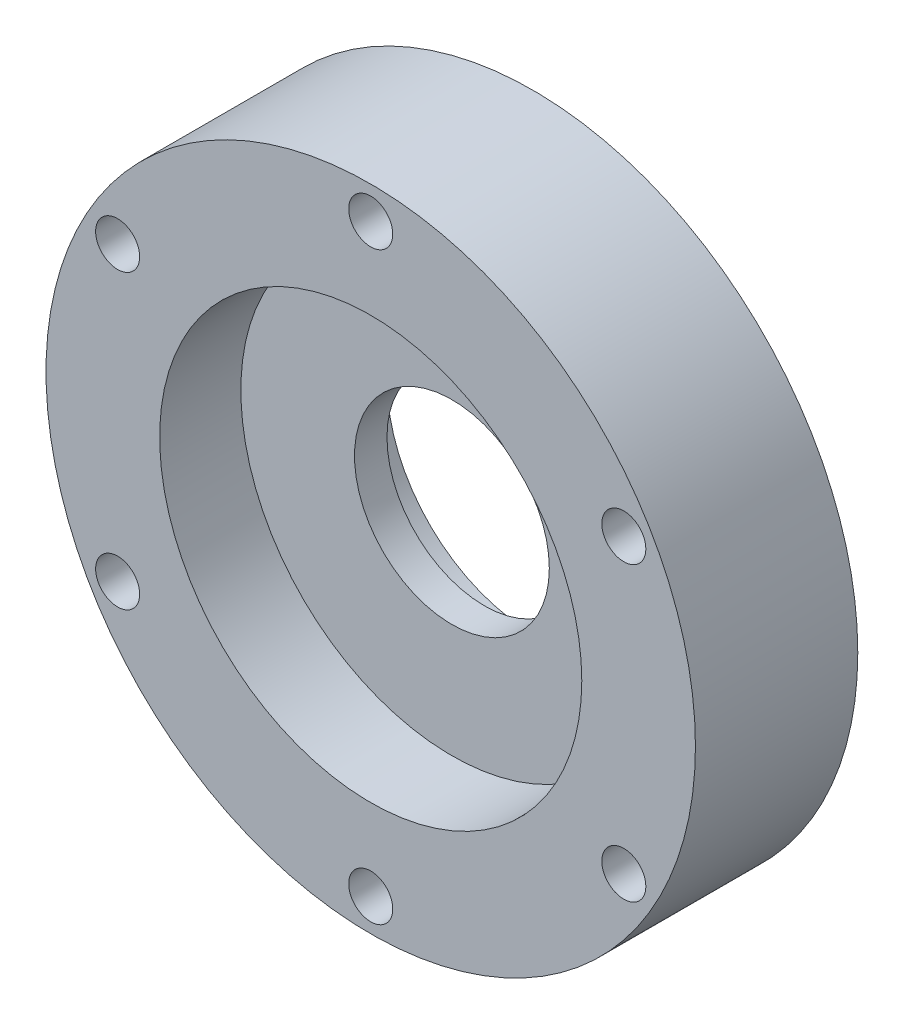
from build123d import *

# Parameters (mm, degrees)
SKETCH1_R             = 31.75
BOSS_EXTRUDE1_DEPTH   = 15.875
SKETCH2_R             = 20.6375
CUT_EXTRUDE1_DEPTH    = 7.9375
SKETCH3_R             = 14.2875
CUT_EXTRUDE2_DEPTH    = 4.7625
SKETCH4_R             = 9.525
CUT_EXTRUDE3_DEPTH    = 46.597466007
F_8_CLEARANCE_HOLE1_D = 4.3053
CUT_EXTRUDE4_DEPTH    = 12.7
CIRPATTERN1_COUNT     = 6
CUT_EXTRUDE5_DEPTH    = 4.7625
CIRPATTERN2_COUNT     = 6


with BuildPart() as part:
    # Sketch1 → Boss-Extrude1 (new body)
    with BuildSketch(Plane.XY):
        Circle(SKETCH1_R)
    extrude(amount=BOSS_EXTRUDE1_DEPTH)

    # Sketch2 → Cut-Extrude1 (cut)
    with BuildSketch(Plane.XY.offset(15.875)):
        Circle(SKETCH2_R)
    extrude(amount=-CUT_EXTRUDE1_DEPTH, mode=Mode.SUBTRACT)

    # Sketch3 → Cut-Extrude2 (cut)
    with BuildSketch(Plane(origin=(0, 0, 0), x_dir=(-1, 0, 0), z_dir=(0, 0, -1))):
        Circle(SKETCH3_R)
    extrude(amount=-CUT_EXTRUDE2_DEPTH, mode=Mode.SUBTRACT)

    # Sketch4 → Cut-Extrude3 (cut, through all)
    with BuildSketch(Plane.XY.offset(7.9375)):
        Circle(SKETCH4_R)
    extrude(amount=-CUT_EXTRUDE3_DEPTH, mode=Mode.SUBTRACT)

    # #8 Clearance Hole1 (through all)
    with Locations(Plane.XY.offset(15.875)):
        with Locations((0, 28.575), (24.746675913, 14.2875), (24.746675913, -14.2875), (0, -28.575), (-24.746675913, -14.2875), (-24.746675913, 14.2875)):
            Hole(F_8_CLEARANCE_HOLE1_D / 2)

    # Sketch8 → Cut-Extrude4 (cut)
    with BuildSketch(Plane(origin=(0, 0, 0), x_dir=(-1, 0, 0), z_dir=(0, 0, -1))):
        with BuildLine():
            ThreePointArc((3.163956488, 28.310416667), (3.772294429, 29.431991344), (5.009597773, 29.743576389))
            ThreePointArc((5.009597773, 29.743576389), (15.08125, 26.121491242), (23.253893866, 19.210227129))
            ThreePointArc((23.253893866, 19.210227129), (23.602704974, 17.982898478), (22.935561781, 16.895275029))
            ThreePointArc((22.935561781, 16.895275029), (21.932102472, 15.756785998), (21.571679673, 14.282613938))
            ThreePointArc((21.571679673, 14.282613938), (21.359607232, 13.487479006), (20.777931553, 12.905355579))
            Line((20.777931553, 12.905355579), (20.125711655, 12.528796246))
            ThreePointArc((20.125711655, 12.528796246), (18.998160274, 12.351602268), (18.043164212, 12.976704136))
            ThreePointArc((18.043164212, 12.976704136), (11.1125, 19.247414599), (2.216573333, 22.11419064))
            ThreePointArc((2.216573333, 22.11419064), (1.197721204, 22.628690556), (0.7874, 23.693775686))
            Line((0.7874, 23.693775686), (0.7874, 24.446894352))
            ThreePointArc((0.7874, 24.446894352), (1.000695836, 25.241701981), (1.583266667, 25.822929568))
            ThreePointArc((1.583266667, 25.822929568), (2.679725721, 26.872150898), (3.163956488, 28.310416667))
        make_face()
    cut_extrude4 = extrude(amount=-CUT_EXTRUDE4_DEPTH, mode=Mode.SUBTRACT)

    # CirPattern1: Cut-Extrude4 ×6 about axis
    cirpattern1_axis = Axis((0, 0, 0), (0, 0, 1))
    for i in range(1, CIRPATTERN1_COUNT):
        add(cut_extrude4.rotate(cirpattern1_axis, i * 360 / CIRPATTERN1_COUNT), mode=Mode.SUBTRACT)

    # Sketch9 → Cut-Extrude5 (cut)
    with BuildSketch(Plane(origin=(0, 0, 0), x_dir=(-1, 0, 0), z_dir=(0, 0, -1))):
        with BuildLine():
            ThreePointArc((3.163956488, 28.310416667), (3.772294429, 29.431991344), (5.009597773, 29.743576389))
            ThreePointArc((5.009597773, 29.743576389), (15.08125, 26.121491242), (23.253893866, 19.210227129))
            ThreePointArc((23.253893866, 19.210227129), (23.602704974, 17.982898478), (22.935561781, 16.895275029))
            ThreePointArc((22.935561781, 16.895275029), (21.932102472, 15.756785998), (21.571679673, 14.282613938))
            ThreePointArc((21.571679673, 14.282613938), (21.359607232, 13.487479006), (20.777931553, 12.905355579))
            Line((20.777931553, 12.905355579), (14.588758649, 9.332034937))
            ThreePointArc((14.588758649, 9.332034937), (13.489603645, 9.149004306), (12.540916954, 9.733500242))
            ThreePointArc((12.540916954, 9.733500242), (7.9375, 13.748153285), (2.159, 15.72750279))
            ThreePointArc((2.159, 15.72750279), (1.178468326, 16.256841597), (0.7874, 17.300253069))
            Line((0.7874, 17.300253069), (0.7874, 24.446894352))
            ThreePointArc((0.7874, 24.446894352), (1.000695836, 25.241701981), (1.583266667, 25.822929568))
            ThreePointArc((1.583266667, 25.822929568), (2.679725721, 26.872150898), (3.163956488, 28.310416667))
        make_face()
    cut_extrude5 = extrude(amount=-CUT_EXTRUDE5_DEPTH, mode=Mode.SUBTRACT)

    # CirPattern2: Cut-Extrude5 ×6 about axis
    cirpattern2_axis = Axis((0, 0, 0), (0, 0, 1))
    for i in range(1, CIRPATTERN2_COUNT):
        add(cut_extrude5.rotate(cirpattern2_axis, i * 360 / CIRPATTERN2_COUNT), mode=Mode.SUBTRACT)


solid = part.part
